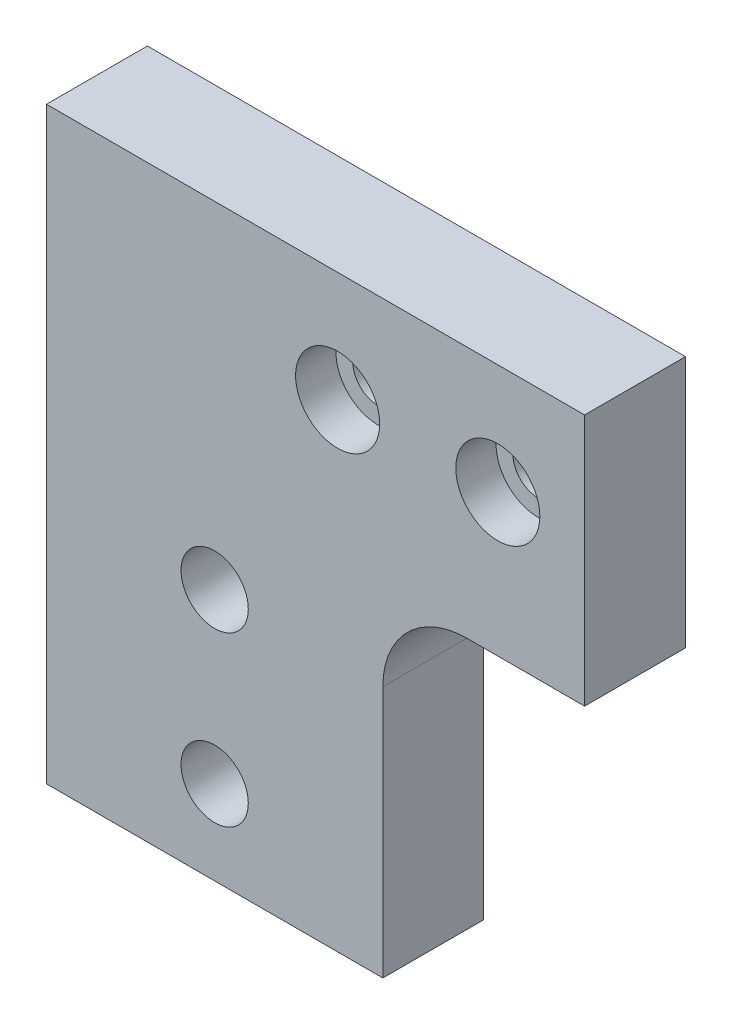
from build123d import *

# Parameters (mm, degrees)
ESBO_O1_W                = 32
ESBO_O1_H                = 35
RESSALTO_EXTRUS_O1_DEPTH = 6
ESBO_O2_R                = 2
ESBO_O2_W                = 12
ESBO_O2_H                = 20
CORTE_EXTRUS_O1_DEPTH    = 6
FILETE1_R                = 5
ESBO_O5_R                = 1.5
CORTE_EXTRUS_O3_DEPTH    = 6
ESBO_O6_R                = 2.5
CORTE_EXTRUS_O4_DEPTH    = 2.4


with BuildPart() as part:
    # Esboço1 → Ressalto-extrusão1 (new body)
    with BuildSketch(Plane.XY):
        Rectangle(ESBO_O1_W, ESBO_O1_H)
    extrude(amount=RESSALTO_EXTRUS_O1_DEPTH)

    # Esboço2 → Corte-extrusão1 (cut)
    with BuildSketch(Plane.XY.offset(6)):
        with Locations((-6, -12.5)):
            Circle(ESBO_O2_R)
        with Locations((-6, -2.5)):
            Circle(ESBO_O2_R)
        with Locations((10, -7.5)):
            Rectangle(ESBO_O2_W, ESBO_O2_H)
    extrude(amount=-CORTE_EXTRUS_O1_DEPTH, mode=Mode.SUBTRACT)

    # Filete1
    filete1_edges = [part.edges().sort_by_distance(p)[0] for p in [
        (4, 2.5, 3),
    ]]
    fillet(filete1_edges, radius=FILETE1_R)

    # Esboço5 → Corte-extrusão3 (cut)
    with BuildSketch(Plane(origin=(0, 0, 0), x_dir=(-1, 0, 0), z_dir=(0, 0, -1))):
        with Locations((-10.8375, 10.9375)):
            Circle(ESBO_O5_R)
        with Locations((-1.3125, 10.9375)):
            Circle(ESBO_O5_R)
    extrude(amount=-CORTE_EXTRUS_O3_DEPTH, mode=Mode.SUBTRACT)

    # Esboço6 → Corte-extrusão4 (cut)
    with BuildSketch(Plane.XY.offset(6)):
        with Locations((10.8375, 10.9375)):
            Circle(ESBO_O6_R)
        with Locations((1.3125, 10.9375)):
            Circle(ESBO_O6_R)
    extrude(amount=-CORTE_EXTRUS_O4_DEPTH, mode=Mode.SUBTRACT)


solid = part.part
